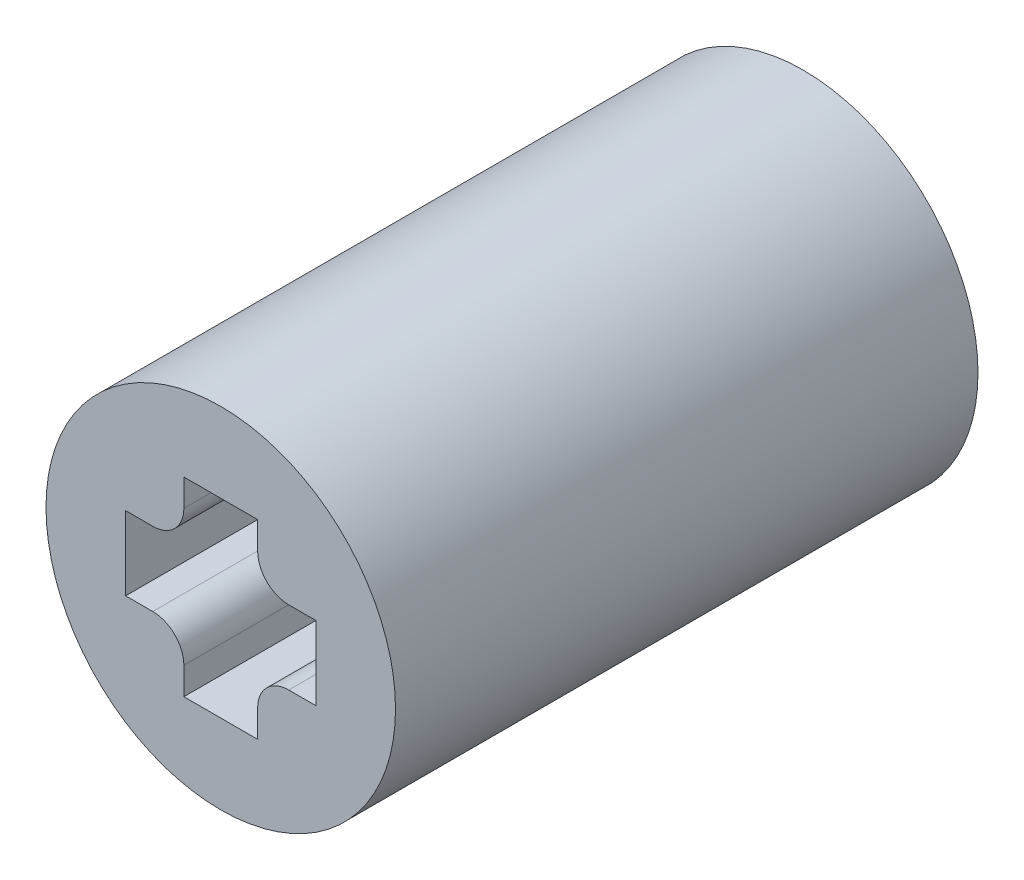
from build123d import *

# Parameters (mm, degrees)
SKETCH1_R           = 4.5
BOSS_EXTRUDE1_DEPTH = 15
SKETCH2_W           = 4
SKETCH2_H           = 6
CUT_EXTRUDE1_DEPTH  = 7
CUT_EXTRUDE2_DEPTH  = 7
FILLET3_R           = 0.8


with BuildPart() as part:
    # Sketch1 → Boss-Extrude1 (new body)
    with BuildSketch(Plane.XY):
        Circle(SKETCH1_R)
    extrude(amount=BOSS_EXTRUDE1_DEPTH)

    # Sketch2 → Cut-Extrude1 (cut)
    with BuildSketch(Plane(origin=(0, 0, 0), x_dir=(-1, 0, 0), z_dir=(0, 0, -1))):
        Rectangle(SKETCH2_W, SKETCH2_H)
    extrude(amount=-CUT_EXTRUDE1_DEPTH, mode=Mode.SUBTRACT)

    # Sketch3 → Cut-Extrude2 (cut)
    with BuildSketch(Plane.XY.offset(15)):
        Polygon((-0.95, -0.95), (-0.95, -2.45), (0.95, -2.45), (0.95, -0.95), (2.45, -0.95), (2.45, 0.95), (0.95, 0.95), (0.95, 2.45), (-0.95, 2.45), (-0.95, 0.95), (-2.45, 0.95), (-2.45, -0.95), align=None)
    extrude(amount=-CUT_EXTRUDE2_DEPTH, mode=Mode.SUBTRACT)

    # Fillet3
    fillet3_edges = [part.edges().sort_by_distance(p)[0] for p in [
        (0.95, -0.95, 11.5),
        (-0.95, -0.95, 11.5),
        (-0.95, 0.95, 11.5),
        (0.95, 0.95, 11.5),
    ]]
    fillet(fillet3_edges, radius=FILLET3_R)


solid = part.part
